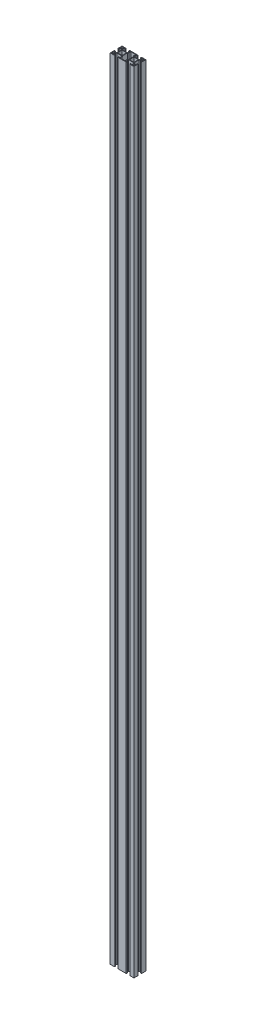
from build123d import *

# Parameters (mm, degrees)
SKETCH_1_W      = 14
SKETCH_1_H      = 14
SKETCH_1_W_2    = 11.6
SKETCH_1_H_2    = 11.6
SKETCH_1_W_3    = 4.6
SKETCH_1_H_3    = 4.6
EXTRUDE_2_DEPTH = 2000


with BuildPart() as part:
    # Эскиз1 → Бобышка-Вытянуть2 (new body)
    # profile 1 of 9: a face of its own
    with BuildSketch(Plane(origin=(0, 0, 0), x_dir=(1, 0, 0), z_dir=(0, 1, 0))):
        Polygon((8, -7), (8, -6.151471863), (6, -8.151471863), (6, -13.6), (-6, -13.6), (-6, -8.151471863), (-8, -6.151471863), (-8, -7), (-8.848528137, -7), (-7, -8.848528137), (-7, -13.4), (-8.9, -13.4), (-8.9, -12.8), (-10.9, -12.8), (-10.9, -14.2), (-10.4, -14.2), (-10.4, -15), (10.4, -15), (10.4, -14.2), (10.9, -14.2), (10.9, -12.8), (8.9, -12.8), (8.9, -13.4), (7, -13.4), (7, -8.848528137), (8.848528137, -7), align=None)
    # profile 2 of 9: a face of its own
    with BuildSketch(Plane(origin=(0, 0, 0), x_dir=(1, 0, 0), z_dir=(0, 1, 0))):
        with Locations((-15, 0)):
            Rectangle(SKETCH_1_W, SKETCH_1_H)
        with Locations((-15, 0)):
            Rectangle(SKETCH_1_W_2, SKETCH_1_H_2, mode=Mode.SUBTRACT)
    # profile 3 of 9: a face of its own
    with BuildSketch(Plane(origin=(0, 0, 0), x_dir=(1, 0, 0), z_dir=(0, 1, 0))):
        Polygon((-23, -8.848528137), (-21.151471863, -7), (-22, -7), (-22, -6.151471863), (-23.848528137, -8), (-28.4, -8), (-28.4, -6.1), (-27.8, -6.1), (-27.8, -4.1), (-29.2, -4.1), (-29.2, -4.6), (-30, -4.6), (-30, -15), (-19.6, -15), (-19.6, -14.2), (-19.1, -14.2), (-19.1, -12.8), (-21.1, -12.8), (-21.1, -13.4), (-23, -13.4), align=None)
        with Locations((-26.3, -11.3)):
            Rectangle(SKETCH_1_W_3, SKETCH_1_H_3, mode=Mode.SUBTRACT)
    # profile 4 of 9: a face of its own
    with BuildSketch(Plane(origin=(0, 0, 0), x_dir=(1, 0, 0), z_dir=(0, 1, 0))):
        with Locations((15, 0)):
            Rectangle(SKETCH_1_W, SKETCH_1_H)
        with Locations((15, 0)):
            Rectangle(SKETCH_1_W_2, SKETCH_1_H_2, mode=Mode.SUBTRACT)
    # profile 5 of 9: a face of its own
    with BuildSketch(Plane(origin=(0, 0, 0), x_dir=(1, 0, 0), z_dir=(0, 1, 0))):
        Polygon((23.848528137, -8), (22, -6.151471863), (22, -7), (21.151471863, -7), (23, -8.848528137), (23, -13.4), (21.1, -13.4), (21.1, -12.8), (19.1, -12.8), (19.1, -14.2), (19.6, -14.2), (19.6, -15), (30, -15), (30, -4.6), (29.2, -4.6), (29.2, -4.1), (27.8, -4.1), (27.8, -6.1), (28.4, -6.1), (28.4, -8), align=None)
        with Locations((26.3, -11.3)):
            Rectangle(SKETCH_1_W_3, SKETCH_1_H_3, mode=Mode.SUBTRACT)
    # profile 6 of 9: a face of its own
    with BuildSketch(Plane(origin=(0, 0, 0), x_dir=(1, 0, 0), z_dir=(0, 1, 0))):
        Polygon((21.151471863, 7), (22, 7), (22, 6.151471863), (23.848528137, 8), (28.4, 8), (28.4, 6.1), (27.8, 6.1), (27.8, 4.1), (29.2, 4.1), (29.2, 4.6), (30, 4.6), (30, 15), (19.6, 15), (19.6, 14.2), (19.1, 14.2), (19.1, 12.8), (21.1, 12.8), (21.1, 13.4), (23, 13.4), (23, 8.848528137), align=None)
        with Locations((26.3, 11.3)):
            Rectangle(SKETCH_1_W_3, SKETCH_1_H_3, mode=Mode.SUBTRACT)
    # profile 7 of 9: a face of its own
    with BuildSketch(Plane(origin=(0, 0, 0), x_dir=(1, 0, 0), z_dir=(0, 1, 0))):
        Polygon((8, 7), (8.848528137, 7), (7, 8.848528137), (7, 13.4), (8.9, 13.4), (8.9, 12.8), (10.9, 12.8), (10.9, 14.2), (10.4, 14.2), (10.4, 15), (-10.4, 15), (-10.4, 14.2), (-10.9, 14.2), (-10.9, 12.8), (-8.9, 12.8), (-8.9, 13.4), (-7, 13.4), (-7, 8.848528137), (-8.848528137, 7), (-8, 7), (-8, 6.151471863), (-6, 8.151471863), (-6, 13.6), (6, 13.6), (6, 8.151471863), (8, 6.151471863), align=None)
    # profile 8 of 9: a face of its own
    with BuildSketch(Plane(origin=(0, 0, 0), x_dir=(1, 0, 0), z_dir=(0, 1, 0))):
        Polygon((-22, 7), (-21.151471863, 7), (-23, 8.848528137), (-23, 13.4), (-21.1, 13.4), (-21.1, 12.8), (-19.1, 12.8), (-19.1, 14.2), (-19.6, 14.2), (-19.6, 15), (-30, 15), (-30, 13.6), (-28.6, 13.6), (-24, 13.6), (-24, 9), (-24, 8.151471863), (-23.848528137, 8), (-22, 6.151471863), align=None)
    # profile 9 of 9: a face of its own
    with BuildSketch(Plane(origin=(0, 0, 0), x_dir=(1, 0, 0), z_dir=(0, 1, 0))):
        Polygon((-28.6, 13.6), (-30, 13.6), (-30, 4.6), (-29.2, 4.6), (-29.2, 4.1), (-27.8, 4.1), (-27.8, 6.1), (-28.4, 6.1), (-28.4, 8), (-23.848528137, 8), (-24, 8.151471863), (-24, 9), (-28.6, 9), align=None)
    extrude(amount=EXTRUDE_2_DEPTH)


solid = part.part
